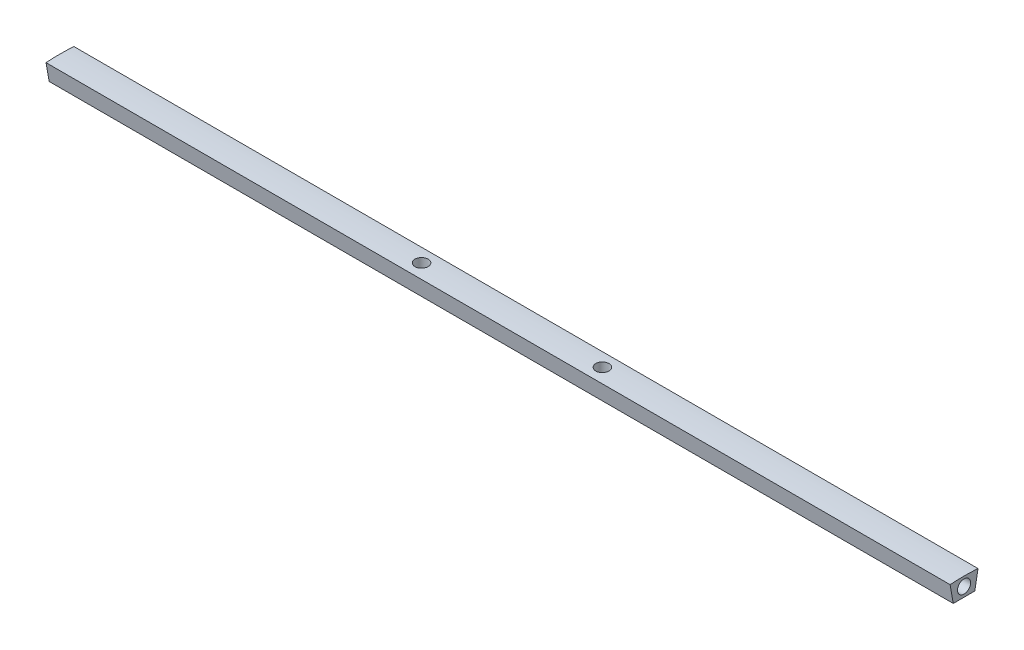
from build123d import *

# Parameters (mm, degrees)
EXTRUDE_1_DEPTH     = 100
SKETCH_2_R          = 1.45
CUT_EXTRUDE_1_DEPTH = 10
SKETCH_3_R          = 1.45
CUT_EXTRUDE_2_DEPTH = 10


with BuildPart() as part:
    # Эскиз1 → Бобышка-Вытянуть1 (new, symmetric)
    with BuildSketch(Plane(origin=(0, 0, 0), x_dir=(0, 0, -1), z_dir=(1, 0, 0))):
        with BuildLine():
            Line((-3.085485457, 17.498657575), (-2.386593122, 13.535042182))
            Line((-2.386593122, 13.535042182), (2.386593122, 13.535042182))
            Line((2.386593122, 13.535042182), (3.085485457, 17.498657575))
            ThreePointArc((3.085485457, 17.498657575), (0, 17.604562424), (-3.085485457, 17.498657575))
        make_face()
    extrude(amount=EXTRUDE_1_DEPTH, both=True)

    # Эскиз2 → Вырез-Вытянуть1 (cut)
    with BuildSketch(Plane(origin=(100, 0, 0), x_dir=(0, 0, -1), z_dir=(1, 0, 0))):
        with Locations((0, 15.604562424)):
            Circle(SKETCH_2_R)
    cut_extrude_1 = extrude(amount=-CUT_EXTRUDE_1_DEPTH, mode=Mode.SUBTRACT)

    # Зеркальное отражение1: Вырез-Вытянуть1 across plane
    add(cut_extrude_1.mirror(Plane(origin=(0, 0, 0), x_dir=(0, 0, 1), z_dir=(1, 0, 0))), mode=Mode.SUBTRACT)

    # Эскиз3 → Вырез-Вытянуть2 (cut)
    with BuildSketch(Plane.XZ.offset(-13.535042182)):
        with Locations(Location((-20, 0, 0), (0, 0, 270))):
            Circle(SKETCH_3_R)
        with Locations(Location((20, 0, 0), (0, 0, 270))):
            Circle(SKETCH_3_R)
    extrude(amount=-CUT_EXTRUDE_2_DEPTH, mode=Mode.SUBTRACT)


solid = part.part
